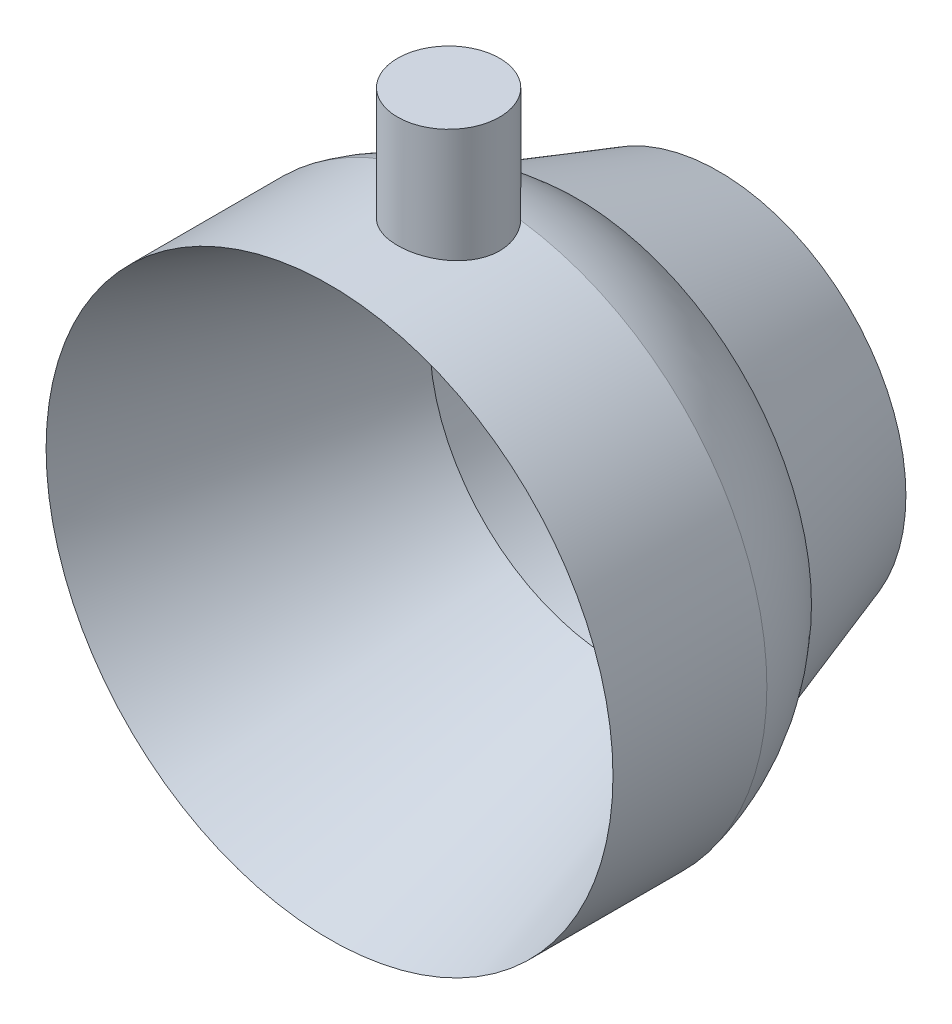
from build123d import *

# Parameters (mm, degrees)
BOSS_EXTRUDE1_START = 16.2
SKETCH3_R           = 3
BOSS_EXTRUDE1_DEPTH = 7


with BuildPart() as part:
    # Sketch2 → Revolve1 (revolve)
    with BuildSketch(Plane(origin=(0, 0, 0), x_dir=(1, 0, 0), z_dir=(0, 1, 0)), mode=Mode.PRIVATE) as revolve1_sk:
        with BuildLine():
            Line((-11, 0), (-11, 6))
            Line((-11, 6), (-13.801099595, -2.351520775))
            ThreePointArc((-13.801099595, -2.351520775), (-15.59397994, -4.904257833), (-16.66244189, -7.835004407))
            Line((-16.66244189, -7.835004407), (-16.66244189, -16.882656067))
            Line((-16.66244189, -16.882656067), (-11, 0))
        make_face()
    revolve(revolve1_sk.sketch.rotate(Axis((0, 0, 0), (0, 0, -1)), 180), axis=Axis((0, 0, 0), (0, 0, -1)))

    # Sketch3 → Boss-Extrude1 (add)
    with BuildSketch(Plane(origin=(0, 0, 0), x_dir=(1, 0, 0), z_dir=(0, 1, 0)).offset(BOSS_EXTRUDE1_START)):
        with Locations(Location((0, -9.882656067, 0), (0, 0, 136.956724762))):
            Circle(SKETCH3_R)
    extrude(amount=BOSS_EXTRUDE1_DEPTH)


solid = part.part
